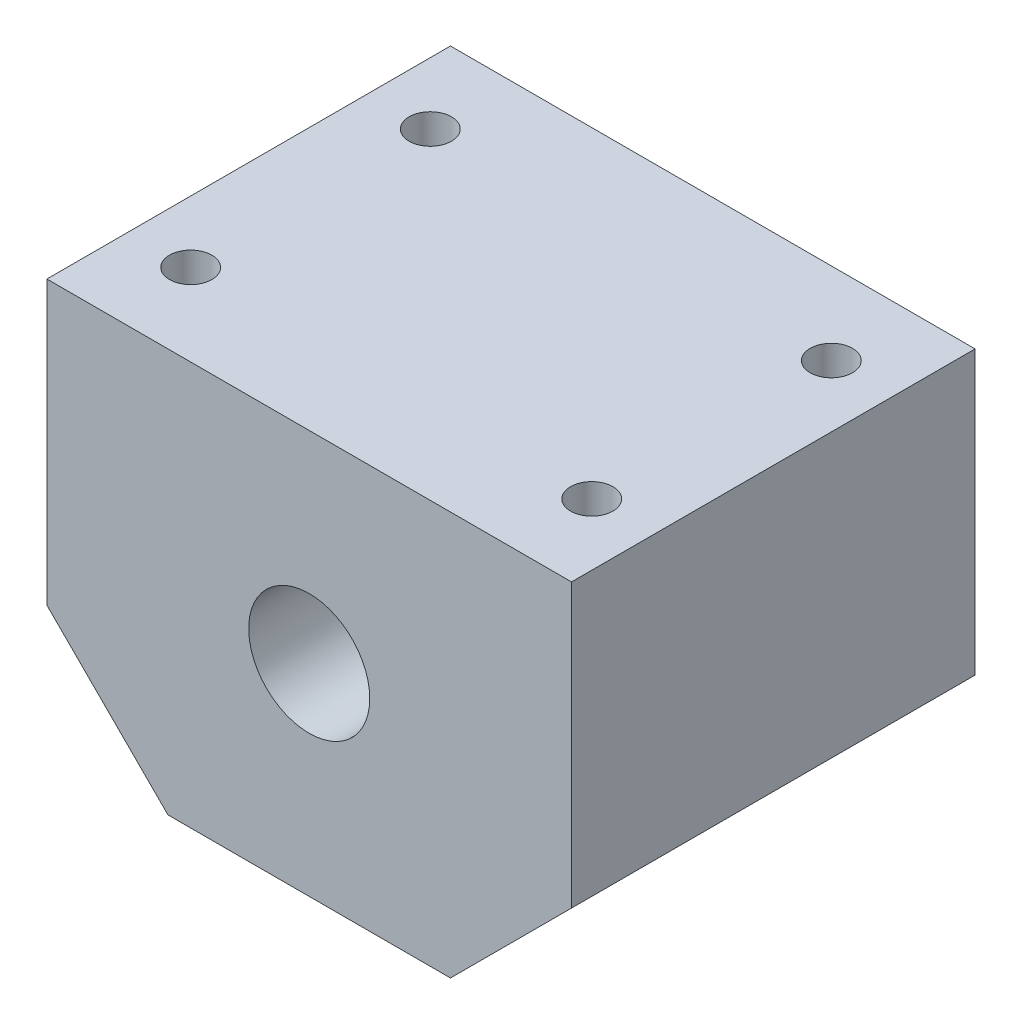
from build123d import *

# Parameters (mm, degrees)
SKETCH1_R           = 6
BOSS_EXTRUDE1_DEPTH = 20
SKETCH2_R           = 2.1
CUT_EXTRUDE1_DEPTH  = 16


with BuildPart() as part:
    # Sketch1 → Boss-Extrude1 (new, symmetric)
    with BuildSketch(Plane.XY):
        Polygon((-26, 20), (-26, -8), (-14, -20), (14, -20), (26, -8), (26, 20), align=None)
        Circle(SKETCH1_R, mode=Mode.SUBTRACT)
    extrude(amount=BOSS_EXTRUDE1_DEPTH, both=True)

    # Sketch2 → Cut-Extrude1 (cut)
    with BuildSketch(Plane(origin=(0, 20, 0), x_dir=(1, 0, 0), z_dir=(0, 1, 0))):
        with Locations(Location((-19.875, 11.875, 0), (0, 0, 270))):
            Circle(SKETCH2_R)
        with Locations(Location((19.875, 11.875, 0), (0, 0, 270))):
            Circle(SKETCH2_R)
        with Locations(Location((19.875, -11.875, 0), (0, 0, 270))):
            Circle(SKETCH2_R)
        with Locations(Location((-19.875, -11.875, 0), (0, 0, 270))):
            Circle(SKETCH2_R)
    extrude(amount=-CUT_EXTRUDE1_DEPTH, mode=Mode.SUBTRACT)


solid = part.part
